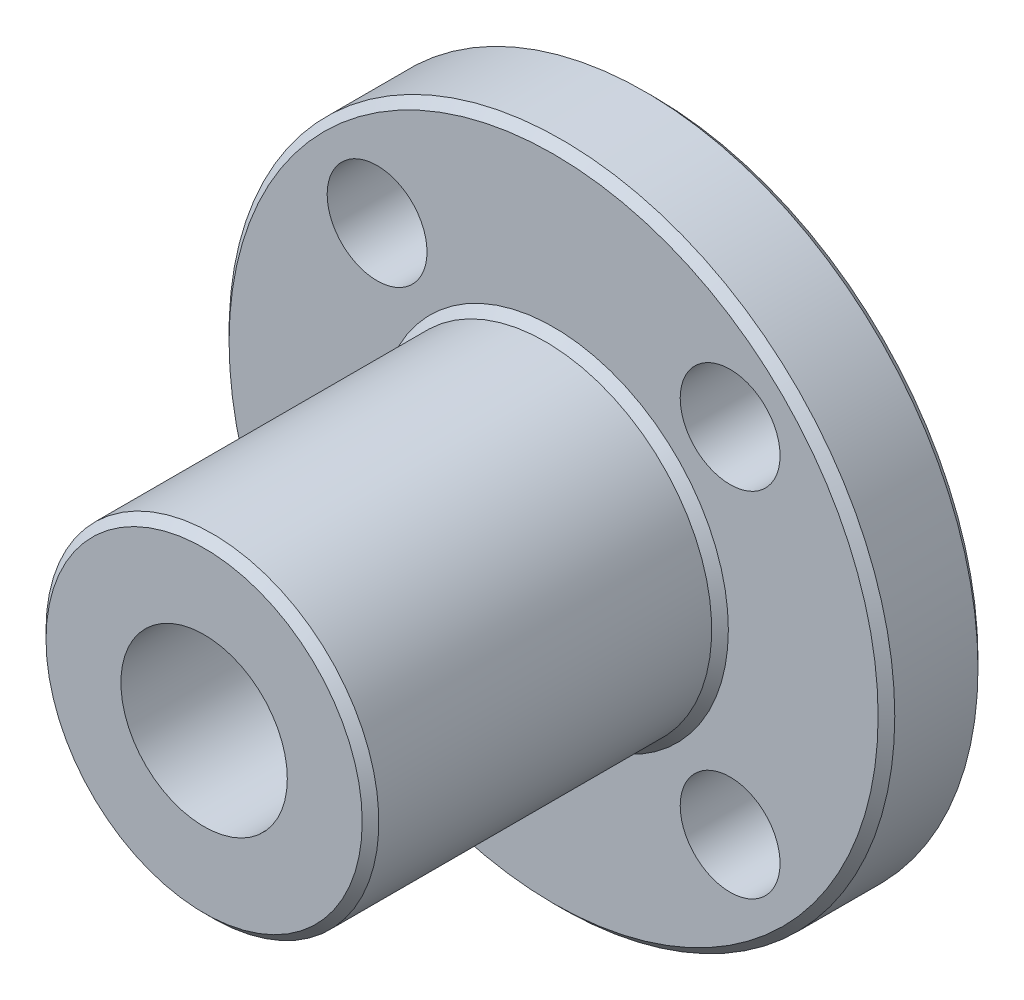
from build123d import *

# Parameters (mm, degrees)
SKETCH1_R               = 10
BOSS_EXTRUDE1_DEPTH     = 3
SKETCH2_R               = 5
BOSS_EXTRUDE2_DEPTH     = 10.5
CUT_EXTRUDE1_DEPTH      = 20.551214796
CUT_EXTRUDE1_DEPTH_BACK = 20.551214796
SKETCH3_R               = 2.5
CHAMFER1_SIZE           = 0.25
CUT_EXTRUDE2_DEPTH      = 20.551214796
CUT_EXTRUDE2_DEPTH_BACK = 20.551214796
SKETCH4_R               = 1.5


with BuildPart() as part:
    # Sketch1 → Boss-Extrude1 (new body)
    with BuildSketch(Plane.XY):
        Circle(SKETCH1_R)
    extrude(amount=BOSS_EXTRUDE1_DEPTH)

    # Sketch2 → Boss-Extrude2 (add)
    with BuildSketch(Plane.XY.offset(3)):
        with Locations(Location((0, 0, 0), (0, 0, 180))):
            Circle(SKETCH2_R)
    extrude(amount=BOSS_EXTRUDE2_DEPTH)

    # Sketch3 → Cut-Extrude1 (cut, two sides: drawn at the far end of the back side and taken through both)
    with BuildSketch(Plane.XY.offset(13.5).offset(-CUT_EXTRUDE1_DEPTH_BACK)):
        Circle(SKETCH3_R)
    extrude(amount=CUT_EXTRUDE1_DEPTH + CUT_EXTRUDE1_DEPTH_BACK, mode=Mode.SUBTRACT)

    # Chamfer1
    chamfer1_edges = [part.edges().sort_by_distance(p)[0] for p in [
        (-10, 0, 0),
        (-10, 0, 3),
        (5, 0, 3),
        (5, 0, 13.5),
    ]]
    chamfer(chamfer1_edges, length=CHAMFER1_SIZE)

    # Sketch4 → Cut-Extrude2 (cut, two sides: drawn at the far end of the back side and taken through both)
    with BuildSketch(Plane(origin=(0, 0, 0), x_dir=(-1, 0, 0), z_dir=(0, 0, -1)).offset(-CUT_EXTRUDE2_DEPTH_BACK)):
        with Locations((-5.303300859, 5.303300859)):
            Circle(SKETCH4_R)
        with Locations((5.303300859, 5.303300859)):
            Circle(SKETCH4_R)
        with Locations((5.303300859, -5.303300859)):
            Circle(SKETCH4_R)
        with Locations((-5.303300859, -5.303300859)):
            Circle(SKETCH4_R)
    extrude(amount=CUT_EXTRUDE2_DEPTH + CUT_EXTRUDE2_DEPTH_BACK, mode=Mode.SUBTRACT)


solid = part.part
